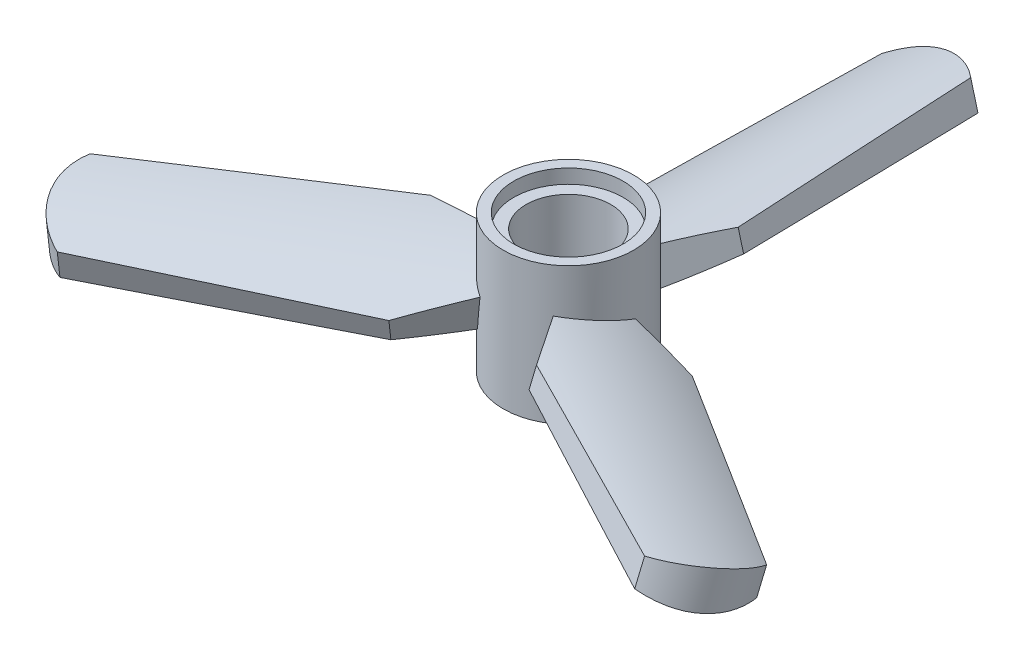
from build123d import *

# Parameters (mm, degrees)
SKETCH1_R             = 3.7
SKETCH1_R_2           = 2.4
HUB_DEPTH             = 3.9
SKETCH2_R             = 3.1
RIM_CUT_DEPTH         = 0.8
BLADE_DEPTH           = 1.1
BLADE_CURVE_DEPTH     = 23.16190425
BODY_MOVE_COPY1_ANGLE = 15
CIRPATTERN1_COUNT     = 3


with BuildPart() as part:
    # Sketch1 → Hub (new, symmetric)
    with BuildSketch(Plane(origin=(0, 0, 0), x_dir=(1, 0, 0), z_dir=(0, 1, 0))):
        Circle(SKETCH1_R)
        Circle(SKETCH1_R_2, mode=Mode.SUBTRACT)
    extrude(amount=HUB_DEPTH, both=True)

    # Sketch2 → Rim Cut (cut)
    with BuildSketch(Plane(origin=(0, 3.9, 0), x_dir=(1, 0, 0), z_dir=(0, 1, 0))):
        Circle(SKETCH2_R)
    rim_cut = extrude(amount=-RIM_CUT_DEPTH, mode=Mode.SUBTRACT)

    # Mirror1: Rim Cut across plane
    add(rim_cut.mirror(Plane.ZX), mode=Mode.SUBTRACT)


with BuildPart() as body_2:
    # Sketch3 → Blade (new, symmetric)
    with BuildSketch(Plane(origin=(0, 0, 0), x_dir=(1, 0, 0), z_dir=(0, 1, 0))):
        with BuildLine():
            Line((-2, 3.7), (-3.35, 6.55))
            Line((-3.35, 6.55), (-2.625, 20.5))
            ThreePointArc((-2.625, 20.5), (0, 21.5), (2.625, 20.5))
            Line((2.625, 20.5), (3.35, 6.55))
            Line((3.35, 6.55), (2, 3.7))
            Line((2, 3.7), (1.526315789, 2.7))
            Line((1.526315789, 2.7), (-1.526315789, 2.7))
            Line((-1.526315789, 2.7), (-2, 3.7))
        make_face()
    extrude(amount=BLADE_DEPTH, both=True)

    # Sketch4 → Blade Curve (cut, through all)
    with BuildSketch(Plane.XY):
        with BuildLine():
            Line((3.35, 0.6), (3.35, 1.1))
            Line((3.35, 1.1), (0, 1.1))
            ThreePointArc((0, 1.1), (1.693553955, 0.974311501), (3.35, 0.6))
        make_face()
        with BuildLine():
            ThreePointArc((-3.35, 0.6), (-1.693553955, 0.974311501), (0, 1.1))
            Line((0, 1.1), (-3.35, 1.1))
            Line((-3.35, 1.1), (-3.35, 0.6))
        make_face()
        with BuildLine():
            ThreePointArc((0, -1.1), (-1.693553955, -0.974311501), (-3.35, -0.6))
            Line((-3.35, -0.6), (-3.35, -1.1))
            Line((-3.35, -1.1), (0, -1.1))
        make_face()
        with BuildLine():
            ThreePointArc((3.35, -0.6), (1.693553955, -0.974311501), (0, -1.1))
            Line((0, -1.1), (3.35, -1.1))
            Line((3.35, -1.1), (3.35, -0.6))
        make_face()
    extrude(amount=-BLADE_CURVE_DEPTH, mode=Mode.SUBTRACT)


with BuildPart() as body_2_1:
    # Body-Move/Copy1: moved
    add(body_2.part.rotate(Axis((0, 0, 0), (0, 0, 1)), BODY_MOVE_COPY1_ANGLE))


with BuildPart() as cirpattern1_1:
    # CirPattern1: pattern copy
    add(body_2_1.part.rotate(Axis((0, 3.9, 0), (0, -1, 0)), 1 * 360 / CIRPATTERN1_COUNT))


with BuildPart() as cirpattern1_2:
    # CirPattern1: pattern copy
    add(body_2_1.part.rotate(Axis((0, 3.9, 0), (0, -1, 0)), 2 * 360 / CIRPATTERN1_COUNT))

    # Combine1: union part, body 2, CirPattern1_1
    add(part.part)
    add(body_2_1.part)
    add(cirpattern1_1.part)


solid = cirpattern1_2.part
